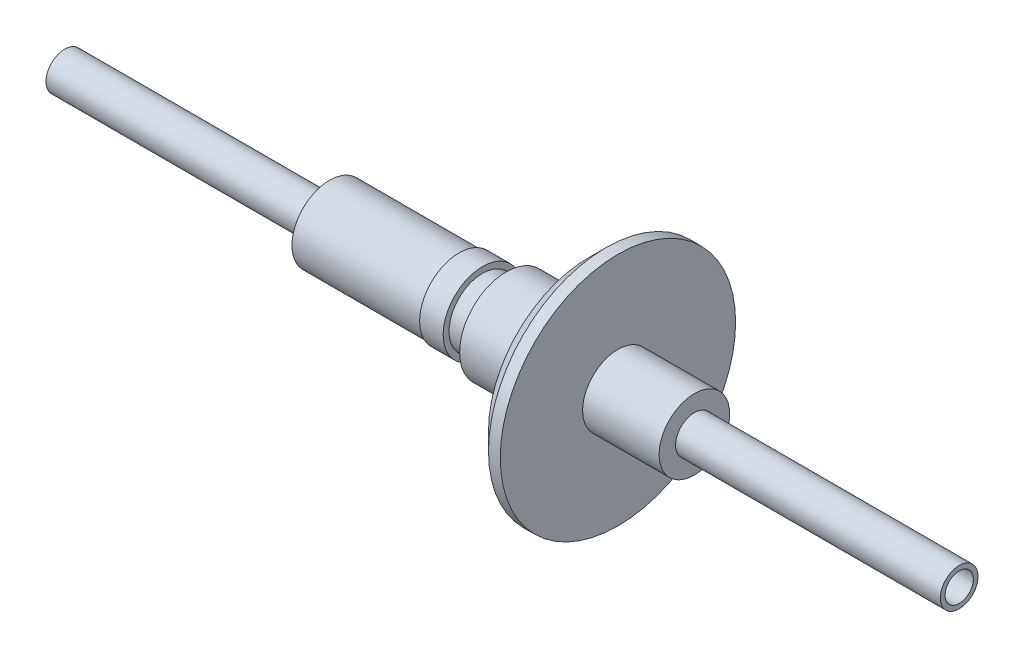
from build123d import *


with BuildPart() as part:
    # Axial profile (mm) → Full revolution (revolve)
    with BuildSketch(Plane.XY, mode=Mode.PRIVATE) as full_revolution_sk:
        Polygon((-94, 2.4), (58, 2.4), (58, 3.2), (13, 3.2), (13, 6), (0, 6), (0, 20), (-2, 20), (-5, 17), (-5, 7.9), (-19, 7.9), (-19, 5.7), (-23, 5.7), (-23, 6.7), (-27, 6.7), (-27, 6.4), (-49, 6.4), (-49, 3.2), (-94, 3.2), align=None)
    revolve(full_revolution_sk.sketch.rotate(Axis((-110, 0, 0), (1, 0, 0)), 90), axis=Axis((-110, 0, 0), (1, 0, 0)))


solid = part.part
